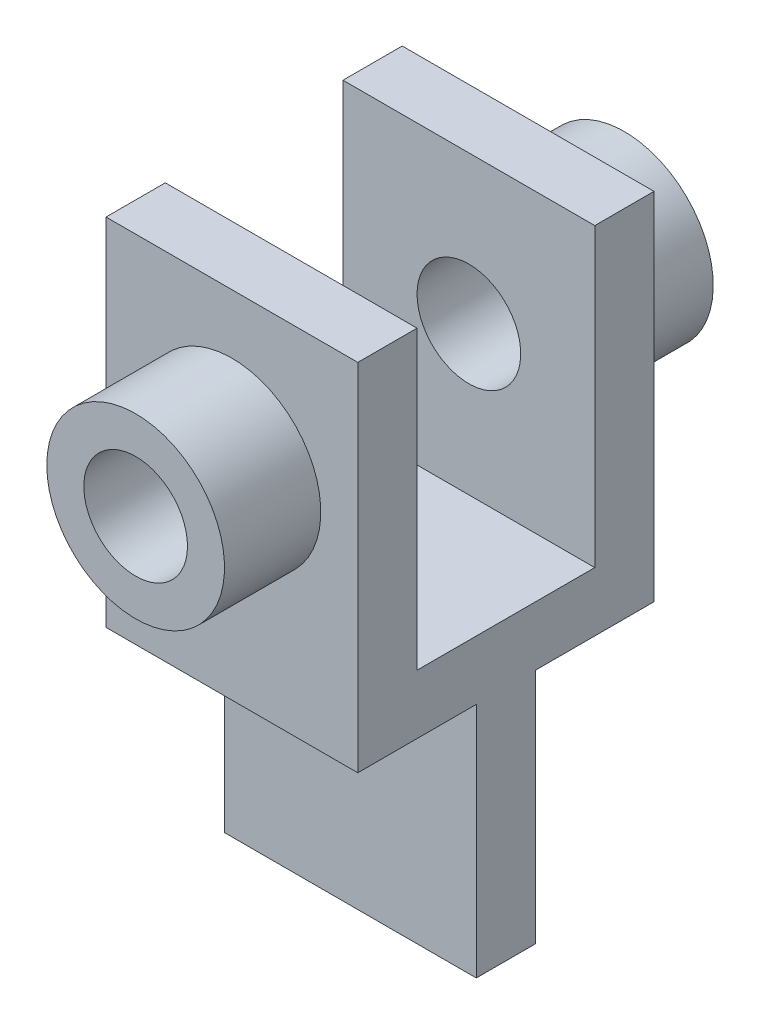
from build123d import *

# Parameters (mm, degrees)
SALIENTE_EXTRUIR1_DEPTH = 17
CROQUIS10_R             = 7
CORTAR_EXTRUIR2_DEPTH   = 92.043945433
SALIENTE_EXTRUIR5_START = 13
CROQUIS11_R             = 12
CROQUIS11_R_2           = 7
SALIENTE_EXTRUIR5_DEPTH = 13
CROQUIS12_R             = 12
CROQUIS12_R_2           = 7
SALIENTE_EXTRUIR6_DEPTH = 13


with BuildPart() as part:
    # Croquis1 → Saliente-Extruir1 (new, symmetric)
    with BuildSketch(Plane(origin=(0, 0, 0), x_dir=(0, 0, -1), z_dir=(1, 0, 0))):
        Polygon((0, 0), (0, 32), (-16, 32), (-16, 80), (-8, 80), (-8, 40), (16, 40), (16, 80), (24, 80), (24, 32), (8, 32), (8, 0), align=None)
    extrude(amount=SALIENTE_EXTRUIR1_DEPTH, both=True)

    # Croquis10 → Cortar-Extruir2 (cut, through all)
    with BuildSketch(Plane.XY.offset(16)):
        with Locations((0, 60)):
            Circle(CROQUIS10_R)
    extrude(amount=-CORTAR_EXTRUIR2_DEPTH, mode=Mode.SUBTRACT)

    # Croquis11 → Saliente-Extruir5 (add)
    with BuildSketch(Plane.XY.offset(16).offset(SALIENTE_EXTRUIR5_START)):
        with Locations(Location((0, 60, 0), (0, 0, 180))):
            Circle(CROQUIS11_R)
        with Locations((0, 60)):
            Circle(CROQUIS11_R_2, mode=Mode.SUBTRACT)
    extrude(amount=-SALIENTE_EXTRUIR5_DEPTH)

    # Croquis12 → Saliente-Extruir6 (add)
    with BuildSketch(Plane(origin=(0, 0, -24), x_dir=(-1, 0, 0), z_dir=(0, 0, -1))):
        with Locations((0, 60)):
            Circle(CROQUIS12_R)
        with Locations(Location((0, 60, 0), (0, 0, 180))):
            Circle(CROQUIS12_R_2, mode=Mode.SUBTRACT)
    extrude(amount=SALIENTE_EXTRUIR6_DEPTH)


solid = part.part
